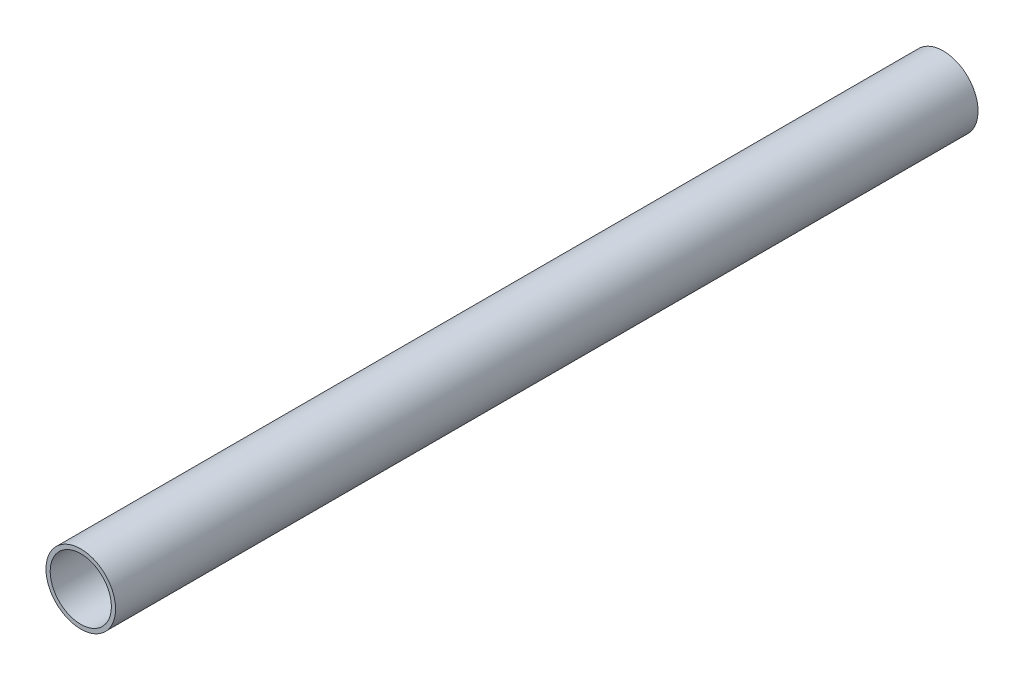
from build123d import *

# Parameters (mm, degrees)
SKETCH1_R           = 12.5
SKETCH1_R_2         = 11
BOSS_EXTRUDE1_DEPTH = 500
SKETCH3_R           = 12.5
SKETCH3_R_2         = 11
CUT_EXTRUDE2_DEPTH  = 190


with BuildPart() as part:
    # Sketch1 → Boss-Extrude1 (new body)
    with BuildSketch(Plane.XY):
        Circle(SKETCH1_R)
        Circle(SKETCH1_R_2, mode=Mode.SUBTRACT)
    extrude(amount=BOSS_EXTRUDE1_DEPTH)

    # Sketch3 → Cut-Extrude2 (cut)
    with BuildSketch(Plane(origin=(0, 0, 0), x_dir=(-1, 0, 0), z_dir=(0, 0, -1))):
        Circle(SKETCH3_R)
        Circle(SKETCH3_R_2, mode=Mode.SUBTRACT)
    extrude(amount=-CUT_EXTRUDE2_DEPTH, mode=Mode.SUBTRACT)


solid = part.part
